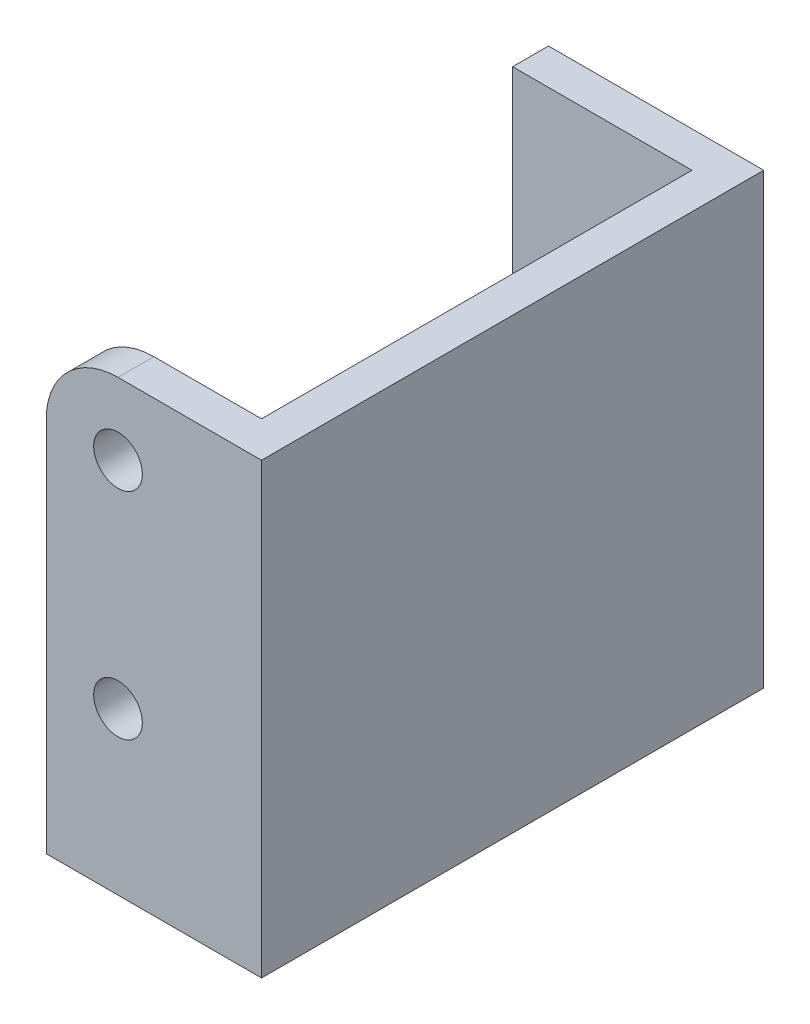
from build123d import *

# Parameters (mm, degrees)
SKETCH1_W           = 19.05
SKETCH1_H           = 39.6875
BOSS_EXTRUDE1_DEPTH = 44.45
SHELL1_T            = -3.175
CUT_EXTRUDE1_REACH  = 51.601
SKETCH2_R           = 2.15265
FILLET2_R           = 6.35


with BuildPart() as part:
    # Sketch1 → Boss-Extrude1 (new body)
    with BuildSketch(Plane.XY):
        Rectangle(SKETCH1_W, SKETCH1_H)
    extrude(amount=-BOSS_EXTRUDE1_DEPTH)

    # Shell1
    shell1_openings = [part.faces().sort_by_distance(p)[0] for p in [
        (-9.525, 0, -22.225),
        (0, 19.84375, -22.225),
    ]]
    offset(amount=SHELL1_T, openings=shell1_openings, kind=Kind.INTERSECTION)

    # Sketch2 → Cut-Extrude1 (cut, up to next)
    with BuildSketch(Plane.XY, mode=Mode.PRIVATE) as cut_extrude1_sk1:
        with Locations((-3.175, -5.55625)):
            Circle(SKETCH2_R)
    cut_extrude1_tool1 = extrude(cut_extrude1_sk1.sketch, amount=-CUT_EXTRUDE1_REACH, mode=Mode.PRIVATE) & part.part
    # Sketch2 → Cut-Extrude1 (cut, up to next)
    with BuildSketch(Plane.XY, mode=Mode.PRIVATE) as cut_extrude1_sk2:
        with Locations((-3.175, 13.49375)):
            Circle(SKETCH2_R)
    cut_extrude1_tool2 = extrude(cut_extrude1_sk2.sketch, amount=-CUT_EXTRUDE1_REACH, mode=Mode.PRIVATE) & part.part
    add(cut_extrude1_tool1.solids().sort_by_distance((-3.175, -5.55625, 0))[0], mode=Mode.SUBTRACT)
    add(cut_extrude1_tool2.solids().sort_by_distance((-3.175, 13.49375, 0))[0], mode=Mode.SUBTRACT)

    # Fillet2
    fillet2_edges = [part.edges().sort_by_distance(p)[0] for p in [
        (-9.525, 19.84375, -1.5875),
    ]]
    fillet(fillet2_edges, radius=FILLET2_R)


solid = part.part
